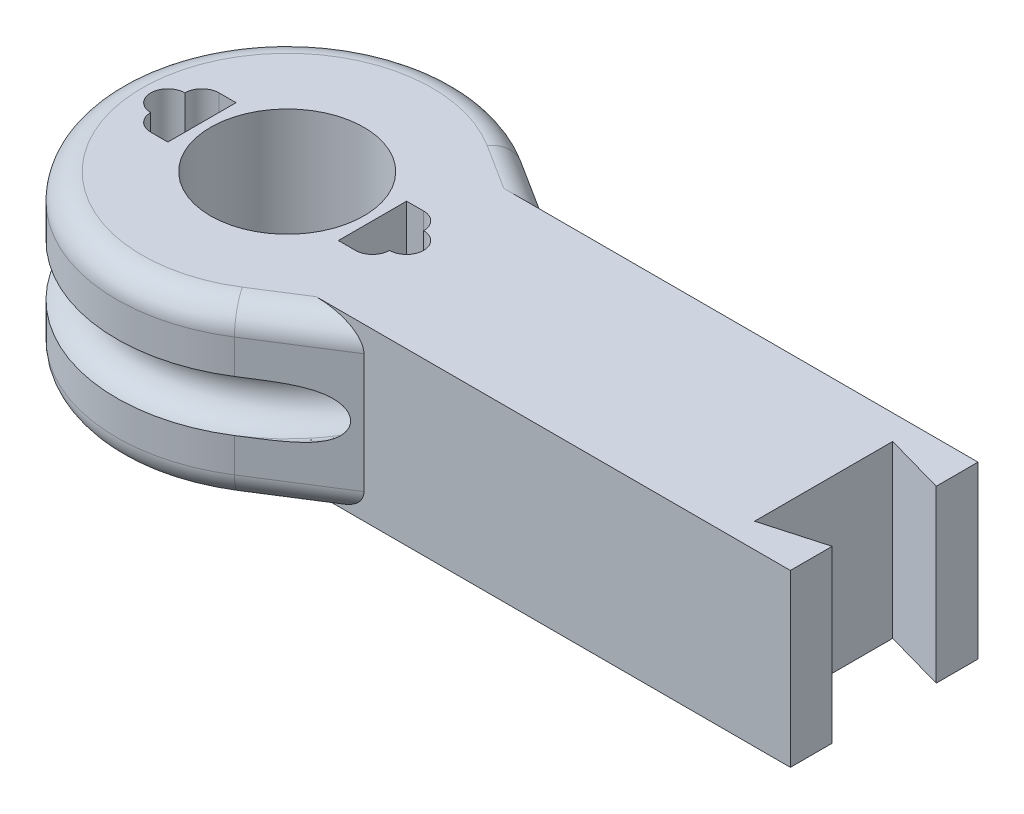
from build123d import *

# Parameters (mm, degrees)
SKETCH1_R           = 4.5
BOSS_EXTRUDE2_DEPTH = 10
FILLET2_R           = 1.5


with BuildPart() as part:
    # Sketch1 → Boss-Extrude2 (new body)
    with BuildSketch(Plane(origin=(0, 0, 0), x_dir=(1, 0, 0), z_dir=(0, 1, 0))):
        with BuildLine():
            Line((35, 5.500000000000003), (10, 5.500000000000003))
            Line((10, 5.500000000000003), (5.355086372360837, 8.445297504798466))
            ThreePointArc((5.355086372360837, 8.445297504798466), (-10, 1.11e-14), (5.355086372360817, -8.445297504798482))
            Line((5.355086372360817, -8.445297504798482), (10, -5.499999999999997))
            Line((10, -5.499999999999997), (34.99999999999999, -5.499999999999997))
            Line((34.99999999999999, -5.499999999999997), (35, -3.05))
            Line((35, -3.05), (31.449999999999992, -4.050000000000006))
            Line((31.449999999999992, -4.050000000000006), (31.450000000000006, 4.049999999999974))
            Line((31.450000000000006, 4.049999999999973), (35, 3.05))
            Line((35, 3.05), (35, 5.500000000000003))
        make_face()
        with BuildLine():
            Line((-5, 2), (-4.999999999999999, -2))
            Line((-4.999999999999999, -2), (-5.999999999999992, -2))
            ThreePointArc((-5.999999999999992, -1.9999999999999998), (-6.707106781186546, -1.7071067811865475), (-6.999999999999999, -0.9999999999999932))
            ThreePointArc((-6.999999999999999, -1.0000000000000002), (-7.999999999999999, -7.6e-16), (-7, 0.9999999999999993))
            ThreePointArc((-7, 0.9999999999999923), (-6.707106781186547, 1.707106781186547), (-5.999999999999993, 2))
            Line((-5.999999999999993, 1.9999999999999996), (-5, 2))
        make_face(mode=Mode.SUBTRACT)
        with Locations(Location((0, 0, 0), (0, 0, 270))):
            Circle(SKETCH1_R, mode=Mode.SUBTRACT)
        with BuildLine():
            Line((4.999999999999999, -2), (5, 2))
            Line((5, 2), (5.999999999999993, 1.9999999999999996))
            ThreePointArc((5.999999999999993, 1.9999999999999998), (6.707106781186548, 1.707106781186547), (7, 0.9999999999999923))
            ThreePointArc((7, 0.9999999999999993), (7.707106781186547, 0.7071067811865467), (7.999999999999999, -4.3e-16))
            ThreePointArc((7.999999999999999, -6.8e-16), (7.707106781186546, -0.707106781186548), (6.999999999999999, -1.0000000000000002))
            ThreePointArc((6.999999999999999, -0.9999999999999932), (6.707106781186546, -1.7071067811865475), (5.999999999999992, -1.9999999999999998))
            Line((5.999999999999992, -2), (4.999999999999999, -2))
        make_face(mode=Mode.SUBTRACT)
    extrude(amount=BOSS_EXTRUDE2_DEPTH)

    # Sketch4 → Cut-Revolve3 (revolve, cut)
    with BuildSketch(Plane(origin=(-6.666818896321271, 16.53530046448365, 0), x_dir=(0, 1, 0), z_dir=(0, 0, 1)), mode=Mode.PRIVATE) as cut_revolve3_sk:
        with BuildLine():
            ThreePointArc((-13.035300464483651, 3.333181103678728), (-11.535300464483651, 1.833181103678728), (-10.035300464483651, 3.333181103678728))
            add(Edge.make_bspline(
                [(-10.035300464483651, 3.333181103678728), (-10.035300464483651, 4.483181103678728), (-11.535300464483651, 4.483181103678728), (-13.035300464483651, 4.483181103678727), (-13.035300464483651, 3.333181103678728)],
                knots=[0, 0, 0, 1.5707963267948966, 1.5707963267948966, 3.141592653589793, 3.141592653589793, 3.141592653589793], degree=2, weights=[1, 0.7071067811865476, 1, 0.7071067811865476, 1]))
        make_face()
    revolve(cut_revolve3_sk.sketch.rotate(Axis((0, 0, 0), (0, 1, 0)), 237.621587486), axis=Axis((0, 0, 0), (0, 1, 0)), mode=Mode.SUBTRACT)

    # Fillet2
    fillet2_edges = [part.edges().sort_by_distance(p)[0] for p in [
        (7.677543186180419, 0, -6.972648752399234),
        (-10, 0, -1.11e-14),
        (7.677543186180419, 10, -6.972648752399234),
        (-10, 10, -1.11e-14),
        (7.677543186180408, 0, 6.972648752399239),
        (7.677543186180408, 10, 6.972648752399239),
    ]]
    fillet(fillet2_edges, radius=FILLET2_R)


solid = part.part
